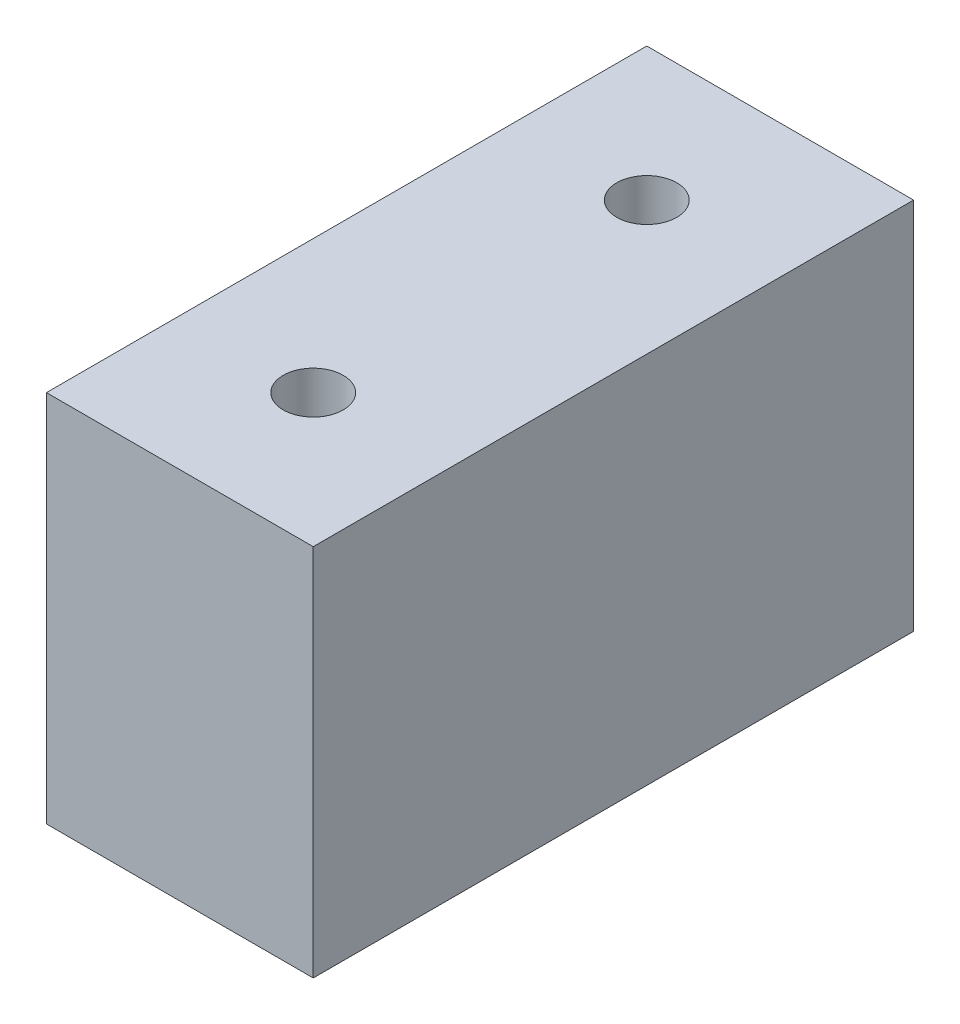
from build123d import *

# Parameters (mm, degrees)
SKETCH_1_W      = 20
SKETCH_1_H      = 45
SKETCH_1_R      = 2.25
EXTRUDE_1_DEPTH = 28


with BuildPart() as part:
    # 草图1 → 凸台-拉伸1 (new body)
    with BuildSketch(Plane(origin=(0, 0, 0), x_dir=(1, 0, 0), z_dir=(0, 1, 0))):
        with Locations((10, 22.5)):
            Rectangle(SKETCH_1_W, SKETCH_1_H)
        with Locations(Location((10, 35, 0), (0, 0, 270))):
            Circle(SKETCH_1_R, mode=Mode.SUBTRACT)
        with Locations(Location((10, 10, 0), (0, 0, 90))):
            Circle(SKETCH_1_R, mode=Mode.SUBTRACT)
    extrude(amount=EXTRUDE_1_DEPTH)


solid = part.part
